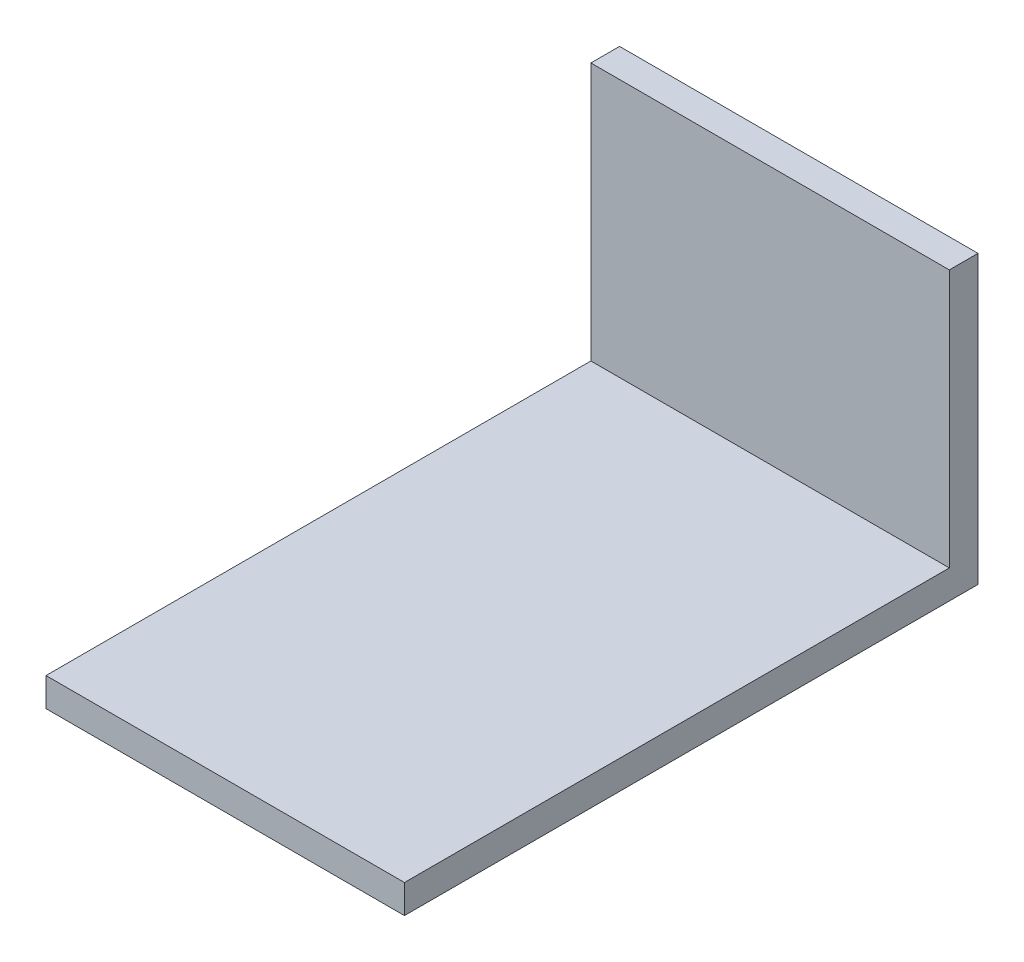
from build123d import *

# Parameters (mm, degrees)
EXTRUDE_1_DEPTH = 50


with BuildPart() as part:
    # Эскиз1 → Бобышка-Вытянуть1 (new body)
    with BuildSketch(Plane(origin=(0, 0, 0), x_dir=(0, 0, -1), z_dir=(1, 0, 0))):
        Polygon((0, 0), (0, 40), (-4, 40), (-4, 4), (-80, 4), (-80, 0), align=None)
    extrude(amount=EXTRUDE_1_DEPTH)


solid = part.part
